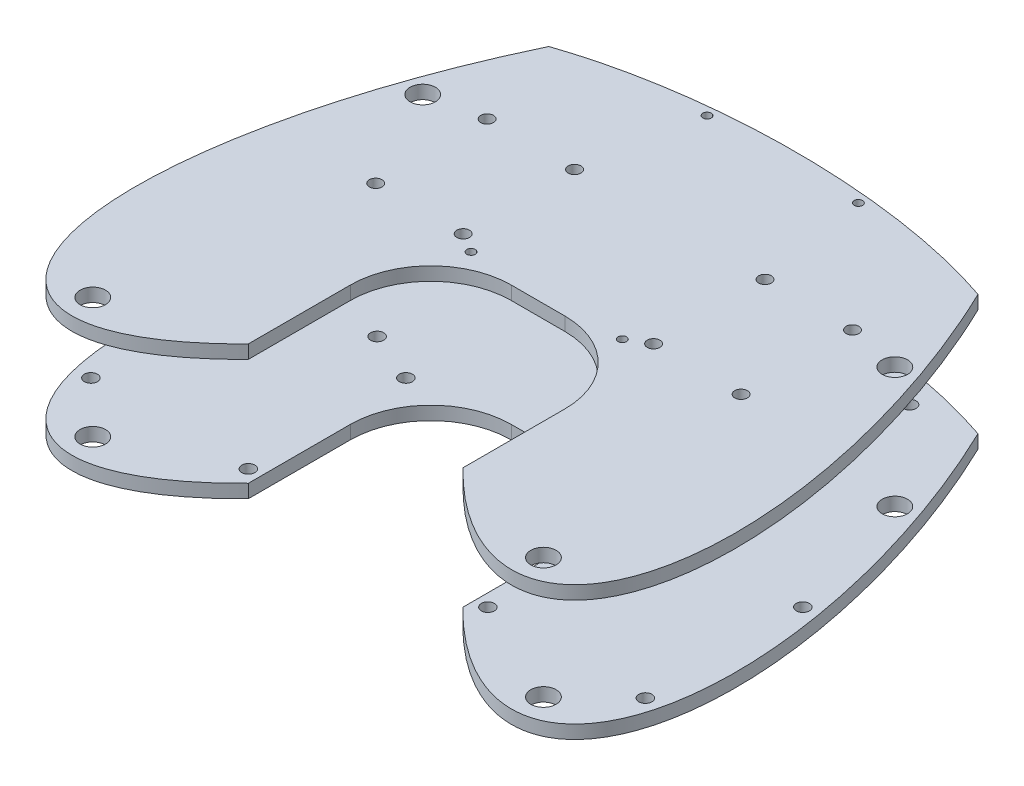
from build123d import *

# Parameters (mm, degrees)
SKETCH1_R           = 1.55
SKETCH1_R_2         = 3
BOSS_EXTRUDE1_DEPTH = 3.175
BOSS_EXTRUDE2_START = 25.4
SKETCH2_R           = 1
SKETCH2_R_2         = 1.5
SKETCH2_R_3         = 3
BOSS_EXTRUDE2_DEPTH = 3.175


with BuildPart() as part:
    # Sketch1 → Boss-Extrude1 (new body)
    with BuildSketch(Plane(origin=(0, 0, 0), x_dir=(1, 0, 0), z_dir=(0, 1, 0))):
        with BuildLine():
            Line((-25.4, -69.85), (-25.4, -45.72))
            ThreePointArc((-25.4, -45.72), (-19.820384182, -32.249615818), (-6.35, -26.67))
            Line((-6.35, -26.67), (6.35, -26.67))
            ThreePointArc((6.35, -26.67), (19.820384182, -32.249615818), (25.4, -45.72))
            Line((25.4, -45.72), (25.4, -69.85))
            add(Edge.make_bspline(
                [(25.4, -69.85), (166.793333333, -214.63), (50.8, 26.67)],
                knots=[5.519550908, 5.519550908, 5.519550908, 8.015672652, 8.015672652, 8.015672652], degree=2, weights=[1, 0.317161971, 1]))
            add(Edge.make_bspline(
                [(50.8, 26.67), (0, 44.087142857), (-50.8, 26.67)],
                knots=[4.032715161, 4.032715161, 4.032715161, 5.392062799, 5.392062799, 5.392062799], degree=2, weights=[1, 0.777777778, 1]))
            add(Edge.make_bspline(
                [(-50.8, 26.67), (-166.793333333, -214.63), (-25.4, -69.85)],
                knots=[4.550697962, 4.550697962, 4.550697962, 7.046819706, 7.046819706, 7.046819706], degree=2, weights=[1, 0.317161971, 1]))
        make_face()
        with Locations(Location((-65.63, -66.9, 0), (0, 0, 270))):
            Circle(SKETCH1_R, mode=Mode.SUBTRACT)
        with Locations(Location((-65.63, -29.62, 0), (0, 0, 270))):
            Circle(SKETCH1_R, mode=Mode.SUBTRACT)
        with Locations(Location((-28.35, -66.9, 0), (0, 0, 270))):
            Circle(SKETCH1_R, mode=Mode.SUBTRACT)
        with Locations(Location((-28.35, -29.62, 0), (0, 0, 270))):
            Circle(SKETCH1_R, mode=Mode.SUBTRACT)
        with Locations(Location((36.749999906, 24.519999982, 0), (0, 0, 270))):
            Circle(SKETCH1_R, mode=Mode.SUBTRACT)
        with Locations(Location((35.65, -24.519999982, 0), (0, 0, 270))):
            Circle(SKETCH1_R, mode=Mode.SUBTRACT)
        with Locations(Location((-46.249999956, 24.519999982, 0), (0, 0, 270))):
            Circle(SKETCH1_R, mode=Mode.SUBTRACT)
        with Locations(Location((-40.250000018, -24.519999982, 0), (0, 0, 270))):
            Circle(SKETCH1_R, mode=Mode.SUBTRACT)
        with Locations(Location((28.35, -66.9, 0), (0, 0, 270))):
            Circle(SKETCH1_R, mode=Mode.SUBTRACT)
        with Locations(Location((65.63, -66.9, 0), (0, 0, 270))):
            Circle(SKETCH1_R, mode=Mode.SUBTRACT)
        with Locations(Location((65.63, -29.62, 0), (0, 0, 270))):
            Circle(SKETCH1_R, mode=Mode.SUBTRACT)
        with Locations(Location((28.35, -29.62, 0), (0, 0, 270))):
            Circle(SKETCH1_R, mode=Mode.SUBTRACT)
        with Locations(Location((-55.88, 1.904184263, 0), (0, 0, 270))):
            Circle(SKETCH1_R_2, mode=Mode.SUBTRACT)
        with Locations(Location((-53.34, -78.74, 0), (0, 0, 270))):
            Circle(SKETCH1_R_2, mode=Mode.SUBTRACT)
        with Locations(Location((53.34, -78.74, 0), (0, 0, 270))):
            Circle(SKETCH1_R_2, mode=Mode.SUBTRACT)
        with Locations(Location((55.88, 1.904184263, 0), (0, 0, 270))):
            Circle(SKETCH1_R_2, mode=Mode.SUBTRACT)
    extrude(amount=BOSS_EXTRUDE1_DEPTH)


with BuildPart() as body_2:
    # Sketch2 → Boss-Extrude2 (new body)
    with BuildSketch(Plane(origin=(0, 3.175, 0), x_dir=(1, 0, 0), z_dir=(0, 1, 0)).offset(BOSS_EXTRUDE2_START)):
        with BuildLine():
            Line((25.4, -45.72), (25.4, -69.85))
            add(Edge.make_bspline(
                [(25.4, -69.85), (166.793333333, -214.63), (50.8, 26.67)],
                knots=[5.519550908, 5.519550908, 5.519550908, 8.015672652, 8.015672652, 8.015672652], degree=2, weights=[1, 0.317161971, 1]))
            add(Edge.make_bspline(
                [(50.8, 26.67), (0, 44.087142857), (-50.8, 26.67)],
                knots=[4.032715161, 4.032715161, 4.032715161, 5.392062799, 5.392062799, 5.392062799], degree=2, weights=[1, 0.777777778, 1]))
            add(Edge.make_bspline(
                [(-50.8, 26.67), (-166.793333333, -214.63), (-25.4, -69.85)],
                knots=[4.550697962, 4.550697962, 4.550697962, 7.046819706, 7.046819706, 7.046819706], degree=2, weights=[1, 0.317161971, 1]))
            Line((-25.4, -69.85), (-25.4, -45.72))
            ThreePointArc((-25.4, -45.72), (-19.820384182, -32.249615818), (-6.35, -26.67))
            Line((-6.35, -26.67), (6.35, -26.67))
            ThreePointArc((6.35, -26.67), (19.820384182, -32.249615818), (25.4, -45.72))
        make_face()
        with Locations(Location((-17.907, 31.242, 0), (0, 0, 270))):
            Circle(SKETCH2_R, mode=Mode.SUBTRACT)
        with Locations(Location((-17.907, -24.638, 0), (0, 0, 270))):
            Circle(SKETCH2_R, mode=Mode.SUBTRACT)
        with Locations(Location((17.907, 31.242, 0), (0, 0, 90))):
            Circle(SKETCH2_R, mode=Mode.SUBTRACT)
        with Locations(Location((17.907, -24.638, 0), (0, 0, 90))):
            Circle(SKETCH2_R, mode=Mode.SUBTRACT)
        with Locations(Location((-43.247, 4.512, 0), (0, 0, 270))):
            Circle(SKETCH2_R_2, mode=Mode.SUBTRACT)
        with Locations(Location((-22.539, 4.512, 0), (0, 0, 270))):
            Circle(SKETCH2_R_2, mode=Mode.SUBTRACT)
        with Locations(Location((-43.247, -21.87, 0), (0, 0, 270))):
            Circle(SKETCH2_R_2, mode=Mode.SUBTRACT)
        with Locations(Location((-22.539, -21.87, 0), (0, 0, 270))):
            Circle(SKETCH2_R_2, mode=Mode.SUBTRACT)
        with Locations(Location((43.247, -21.87, 0), (0, 0, 90))):
            Circle(SKETCH2_R_2, mode=Mode.SUBTRACT)
        with Locations(Location((22.539, -21.87, 0), (0, 0, 90))):
            Circle(SKETCH2_R_2, mode=Mode.SUBTRACT)
        with Locations(Location((22.539, 4.512, 0), (0, 0, 90))):
            Circle(SKETCH2_R_2, mode=Mode.SUBTRACT)
        with Locations(Location((43.247, 4.512, 0), (0, 0, 90))):
            Circle(SKETCH2_R_2, mode=Mode.SUBTRACT)
        with Locations(Location((-53.34, -78.74, 0), (0, 0, 270))):
            Circle(SKETCH2_R_3, mode=Mode.SUBTRACT)
        with Locations(Location((53.34, -78.74, 0), (0, 0, 270))):
            Circle(SKETCH2_R_3, mode=Mode.SUBTRACT)
        with Locations(Location((55.88, 1.904184263, 0), (0, 0, 270))):
            Circle(SKETCH2_R_3, mode=Mode.SUBTRACT)
        with Locations(Location((-55.88, 1.904184263, 0), (0, 0, 270))):
            Circle(SKETCH2_R_3, mode=Mode.SUBTRACT)
    extrude(amount=BOSS_EXTRUDE2_DEPTH)


solid = Compound([part.part, body_2.part])
